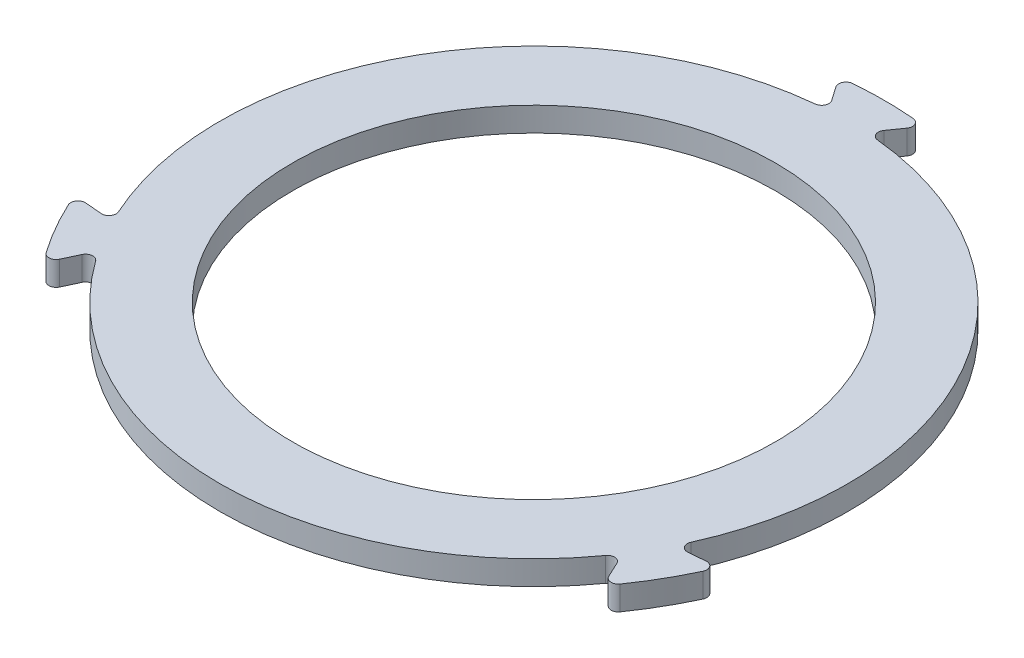
from build123d import *

# Parameters (mm, degrees)
SKETCH2_W                = 15
SKETCH2_H                = 5
BOSS_EXTRUDE1_DEPTH      = 5
FILLET2_R                = 1.5
CIRPATTERN4_COUNT        = 3
FILLET2_OF_CIRPATTERN4_R = 1.5


with BuildPart() as part:
    # Sketch2 → Revolve1 (revolve)
    with BuildSketch(Plane(origin=(0, 0, 0), x_dir=(0, 0, -1), z_dir=(1, 0, 0)), mode=Mode.PRIVATE) as revolve1_sk:
        with Locations((-57.5, 2.5)):
            Rectangle(SKETCH2_W, SKETCH2_H)
    revolve(revolve1_sk.sketch.rotate(Axis((0, -0.75, 0), (0, 1, 0)), 180), axis=Axis((0, -0.75, 0), (0, 1, 0)))

    # Sketch4 → Boss-Extrude1 (add)
    with BuildSketch(Plane(origin=(0, 5, 0), x_dir=(1, 0, 0), z_dir=(0, 1, 0))):
        with BuildLine():
            Line((-3.881158746, 64.88402428), (-8.835527397, 71.959595994))
            ThreePointArc((-8.835527397, 71.959595994), (0, 72.5), (8.835527397, 71.959595994))
            Line((8.835527397, 71.959595994), (3.881158746, 64.88402428))
            ThreePointArc((3.881158746, 64.88402428), (0, 65), (-3.881158746, 64.88402428))
        make_face()
    boss_extrude1 = extrude(amount=-BOSS_EXTRUDE1_DEPTH)

    # Fillet2
    fillet2_edges = [part.edges().sort_by_distance(p)[0] for p in [
        (3.881158746, 2.5, -64.88402428),
        (-3.881158746, 2.5, -64.88402428),
        (-8.835527397, 2.5, -71.959595994),
        (8.835527397, 2.5, -71.959595994),
    ]]
    fillet(fillet2_edges, radius=FILLET2_R)

    # CirPattern4: Boss-Extrude1 ×3 about axis
    cirpattern4_axis = Axis((0, 0, 0), (0, 1, 0))
    for i in range(1, CIRPATTERN4_COUNT):
        add(boss_extrude1.rotate(cirpattern4_axis, i * 360 / CIRPATTERN4_COUNT))

    # Fillet2 of CirPattern4
    fillet2_of_cirpattern4_edges = [part.edges().sort_by_distance(p)[0] for p in [
        (-58.131792699, 2.5, 29.08083007),
        (-54.250633954, 2.5, 35.80319421),
        (-57.901074478, 2.5, 43.631589179),
        (-66.736601875, 2.5, 28.328006815),
        (54.250633954, 2.5, 35.80319421),
        (58.131792699, 2.5, 29.08083007),
        (66.736601875, 2.5, 28.328006815),
        (57.901074478, 2.5, 43.631589179),
    ]]
    fillet(fillet2_of_cirpattern4_edges, radius=FILLET2_OF_CIRPATTERN4_R)


solid = part.part
